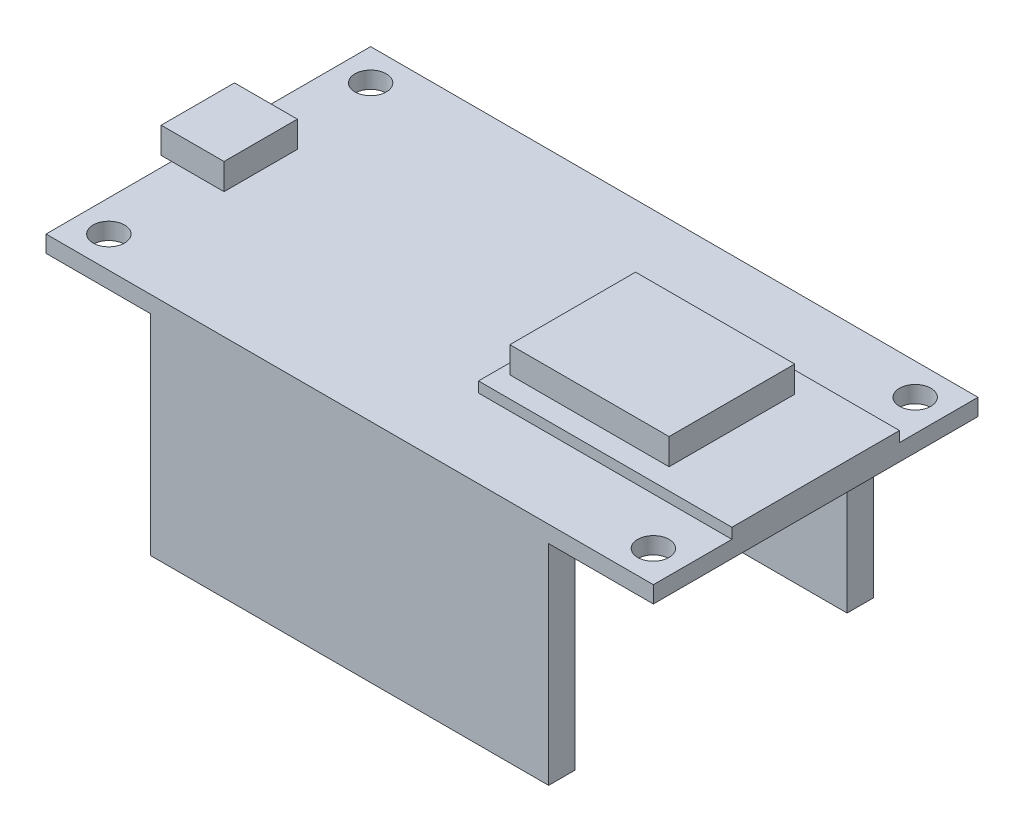
from build123d import *

# Parameters (mm, degrees)
SKETCH1_W          = 58
SKETCH1_H          = 31
CIRCUIT_DEPTH      = 1.6
SKETCH2_W          = 24.2
SKETCH2_H          = 16
ESP_PCB_DEPTH      = 1
SKETCH3_W          = 15.2
SKETCH3_H          = 12
ESP_CHIP_DEPTH     = 2.5
SKETCH4_W          = 5
SKETCH4_H          = 7
PCB_HOLES_DEPTH    = 2.5
SKETCH5_R          = 1.5
CUT_EXTRUDE1_DEPTH = 34.068111528
SKETCH6_W          = 7
SKETCH6_H          = 2.5
USB_DEPTH          = 1
SKETCH7_W          = 38
SKETCH7_H          = 2.5
PINS_DEPTH         = 20


with BuildPart() as part:
    # Sketch1 → CIRCUIT (new body)
    with BuildSketch(Plane(origin=(0, 0, 0), x_dir=(1, 0, 0), z_dir=(0, 1, 0))):
        Rectangle(SKETCH1_W, SKETCH1_H)
    extrude(amount=CIRCUIT_DEPTH)

    # Sketch2 → ESP_PCB (add)
    with BuildSketch(Plane(origin=(0, 1.6, 0), x_dir=(1, 0, 0), z_dir=(0, 1, 0))):
        with Locations((16.9, 0)):
            Rectangle(SKETCH2_W, SKETCH2_H)
    extrude(amount=ESP_PCB_DEPTH)

    # Sketch3 → ESP_CHIP (add)
    with BuildSketch(Plane(origin=(0, 2.6, 0), x_dir=(1, 0, 0), z_dir=(0, 1, 0))):
        with Locations((13.4, 0)):
            Rectangle(SKETCH3_W, SKETCH3_H)
    extrude(amount=ESP_CHIP_DEPTH)

    # Sketch4 → PCB_HOLES (add)
    with BuildSketch(Plane(origin=(0, 1.6, 0), x_dir=(1, 0, 0), z_dir=(0, 1, 0))):
        with Locations((-26.5, 0)):
            Rectangle(SKETCH4_W, SKETCH4_H)
    extrude(amount=PCB_HOLES_DEPTH)

    # Sketch5 → Cut-Extrude1 (cut, through all)
    with BuildSketch(Plane(origin=(0, 1.6, 0), x_dir=(1, 0, 0), z_dir=(0, 1, 0))):
        with Locations(Location((-26, 12.5, 0), (0, 0, 270))):
            Circle(SKETCH5_R)
        with Locations(Location((-26, -12.5, 0), (0, 0, 270))):
            Circle(SKETCH5_R)
        with Locations(Location((26, 12.5, 0), (0, 0, 270))):
            Circle(SKETCH5_R)
        with Locations(Location((26, -12.5, 0), (0, 0, 270))):
            Circle(SKETCH5_R)
    extrude(amount=-CUT_EXTRUDE1_DEPTH, mode=Mode.SUBTRACT)

    # Sketch6 → USB (add)
    with BuildSketch(Plane.ZY.offset(29)):
        with Locations((0, 2.85)):
            Rectangle(SKETCH6_W, SKETCH6_H)
    extrude(amount=USB_DEPTH)

    # Sketch7 → PINS (add)
    with BuildSketch(Plane.XZ):
        with Locations((0, 14.25)):
            Rectangle(SKETCH7_W, SKETCH7_H)
        with Locations((0, -14.25)):
            Rectangle(SKETCH7_W, SKETCH7_H)
    extrude(amount=PINS_DEPTH)


solid = part.part
